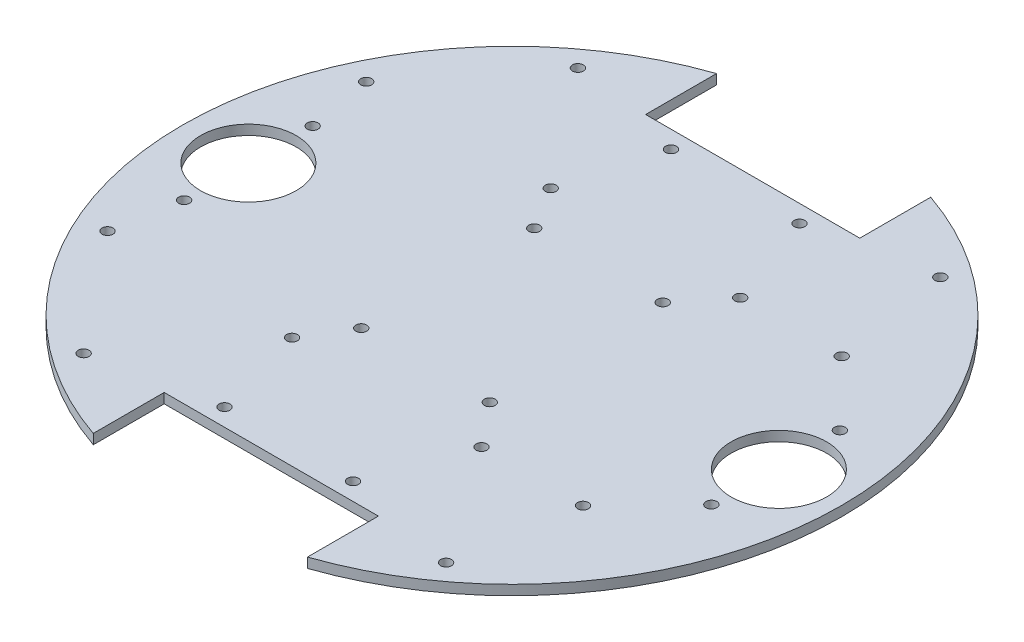
from build123d import *

# Parameters (mm, degrees)
CROQUIS1_R              = 1.65
CROQUIS1_R_2            = 14.5
SALIENTE_EXTRUIR1_DEPTH = 3
CROQUIS2_W              = 1.949367088
CROQUIS2_H              = 14
CROQUIS2_W_2            = 1.772151899
CROQUIS2_H_2            = 10.455696203
CROQUIS2_H_3            = 2.126582279
CORTAR_EXTRUIR1_DEPTH   = 1


with BuildPart() as part:
    # Croquis1 → Saliente-Extruir1 (new body)
    with BuildSketch(Plane(origin=(0, 0, 0), x_dir=(1, 0, 0), z_dir=(0, 1, 0))):
        with BuildLine():
            Line((-32.5, -73.047542064), (32.5, -73.047542064))
            Line((32.5, -73.047542064), (32.5, -94.571401597))
            ThreePointArc((32.5, -94.571401597), (100, 0), (32.5, 94.571401597))
            Line((32.5, 94.571401597), (32.5, 73.047542064))
            Line((32.5, 73.047542064), (-32.5, 73.047542064))
            Line((-32.5, 73.047542064), (-32.5, 94.571401597))
            ThreePointArc((-32.5, 94.571401597), (-100, 0), (-32.5, -94.571401597))
            Line((-32.5, -94.571401597), (-32.5, -73.047542064))
        make_face()
        with Locations(Location((-80, 19.5, 0), (0, 0, 270))):
            Circle(CROQUIS1_R, mode=Mode.SUBTRACT)
        with Locations(Location((-80, -19.5, 0), (0, 0, 90))):
            Circle(CROQUIS1_R, mode=Mode.SUBTRACT)
        with Locations(Location((80, -19.5, 0), (0, 0, 270))):
            Circle(CROQUIS1_R, mode=Mode.SUBTRACT)
        with Locations(Location((80, 19.5, 0), (0, 0, 90))):
            Circle(CROQUIS1_R, mode=Mode.SUBTRACT)
        with Locations(Location((55, 75, 0), (0, 0, 270))):
            Circle(CROQUIS1_R, mode=Mode.SUBTRACT)
        with Locations(Location((-55, 75, 0), (0, 0, 90))):
            Circle(CROQUIS1_R, mode=Mode.SUBTRACT)
        with Locations(Location((55, -75, 0), (0, 0, 90))):
            Circle(CROQUIS1_R, mode=Mode.SUBTRACT)
        with Locations(Location((-55, -75, 0), (0, 0, 270))):
            Circle(CROQUIS1_R, mode=Mode.SUBTRACT)
        with Locations(Location((-80, 0, 0), (0, 0, 270))):
            Circle(CROQUIS1_R_2, mode=Mode.SUBTRACT)
        with Locations(Location((80.990943561, 0, 0), (0, 0, 270))):
            Circle(CROQUIS1_R_2, mode=Mode.SUBTRACT)
        with Locations(Location((-19.5, -67.747542064, 0), (0, 0, 270))):
            Circle(CROQUIS1_R, mode=Mode.SUBTRACT)
        with Locations(Location((19.5, -67.747542064, 0), (0, 0, 90))):
            Circle(CROQUIS1_R, mode=Mode.SUBTRACT)
        with Locations(Location((-19.5, -26.247542064, 0), (0, 0, 270))):
            Circle(CROQUIS1_R, mode=Mode.SUBTRACT)
        with Locations(Location((19.5, -26.247542064, 0), (0, 0, 90))):
            Circle(CROQUIS1_R, mode=Mode.SUBTRACT)
        with Locations(Location((19.5, 26.247542064, 0), (0, 0, 270))):
            Circle(CROQUIS1_R, mode=Mode.SUBTRACT)
        with Locations(Location((-19.5, 26.247542064, 0), (0, 0, 90))):
            Circle(CROQUIS1_R, mode=Mode.SUBTRACT)
        with Locations(Location((-19.5, 67.747542064, 0), (0, 0, 90))):
            Circle(CROQUIS1_R, mode=Mode.SUBTRACT)
        with Locations(Location((19.5, 67.747542064, 0), (0, 0, 270))):
            Circle(CROQUIS1_R, mode=Mode.SUBTRACT)
        with Locations(Location((-27.5, -39.247542064, 0), (0, 0, 270))):
            Circle(CROQUIS1_R, mode=Mode.SUBTRACT)
        with Locations(Location((-83.5, -39.247542064, 0), (0, 0, 270))):
            Circle(CROQUIS1_R, mode=Mode.SUBTRACT)
        with Locations(Location((60.8, -39.247542064, 0), (0, 0, 270))):
            Circle(CROQUIS1_R, mode=Mode.SUBTRACT)
        with Locations(Location((30, -39.247542064, 0), (0, 0, 90))):
            Circle(CROQUIS1_R, mode=Mode.SUBTRACT)
        with Locations(Location((-27.5, 39.247542064, 0), (0, 0, 90))):
            Circle(CROQUIS1_R, mode=Mode.SUBTRACT)
        with Locations(Location((-83.5, 39.247542064, 0), (0, 0, 90))):
            Circle(CROQUIS1_R, mode=Mode.SUBTRACT)
        with Locations(Location((60.8, 39.247542064, 0), (0, 0, 90))):
            Circle(CROQUIS1_R, mode=Mode.SUBTRACT)
        with Locations(Location((30, 39.247542064, 0), (0, 0, 270))):
            Circle(CROQUIS1_R, mode=Mode.SUBTRACT)
    extrude(amount=SALIENTE_EXTRUIR1_DEPTH)

    # Croquis2 → Cortar-Extruir1 (cut)
    # profile 1 of 16: a face of its own
    with BuildSketch(Plane.XZ):
        with Locations((-20.734177215, 10.957677532)):
            Rectangle(CROQUIS2_W, CROQUIS2_H)
    # profile 2 of 16: a face of its own
    with BuildSketch(Plane.XZ):
        Polygon((-17.810126582, 17.957677532), (-5.936708861, 17.957677532), (-5.936708861, 16.362740824), (-10.898734177, 16.362740824), (-10.898734177, 3.957677532), (-12.848101266, 3.957677532), (-12.848101266, 16.362740824), (-17.810126582, 16.362740824), align=None)
    # profile 3 of 16: a face of its own
    with BuildSketch(Plane.XZ):
        Polygon((-0.620253165, 17.957677532), (1.514636076, 17.957677532), (6.82278481, 3.957677532), (4.865110759, 3.957677532), (3.596914557, 7.50198133), (-2.680379747, 7.50198133), (-3.951344937, 3.957677532), (-5.936708861, 3.957677532), align=None)
        Polygon((0.443037975, 16.085842089), (-2.112737342, 9.096918039), (3.007120253, 9.096918039), align=None, mode=Mode.SUBTRACT)
    # profile 4 of 16: a face of its own
    with BuildSketch(Plane.XZ):
        Polygon((8.772151899, 17.957677532), (11.67681962, 17.957677532), (15.146360759, 8.401902216), (18.63528481, 17.957677532), (21.53164557, 17.957677532), (21.53164557, 3.957677532), (19.582278481, 3.957677532), (19.582278481, 16.246443355), (16.076740506, 6.61590538), (14.227056962, 6.61590538), (10.721518987, 16.246443355), (10.721518987, 3.957677532), (8.772151899, 3.957677532), align=None)
    # profile 5 of 16: a face of its own
    with BuildSketch(Plane.XZ):
        with Locations((-45.012658228, -12.194221202)):
            Rectangle(CROQUIS2_W, CROQUIS2_H)
    # profile 6 of 16: a face of its own
    with BuildSketch(Plane.XZ):
        with BuildLine():
            Line((-31.632911392, -12.861547151), (-31.632911392, -19.194221202))
            Line((-31.632911392, -19.194221202), (-33.405063291, -19.194221202))
            Line((-33.405063291, -19.194221202), (-33.405063291, -12.919695885))
            add(Edge.make_bspline(
                [(-33.405063291, -12.919695885), (-33.406185811, -12.79317353), (-33.408360053, -12.548108723), (-33.438421939, -12.193477321), (-33.477293835, -11.862867023), (-33.537940281, -11.557207684), (-33.618132247, -11.276724941), (-33.715424889, -11.020143481), (-33.827376724, -10.787158806), (-33.959212498, -10.578879816), (-34.10878902, -10.395598763), (-34.275950383, -10.236005976), (-34.461613667, -10.101752429), (-34.66356152, -9.989805878), (-34.885462049, -9.90769479), (-35.122950473, -9.846898708), (-35.37796802, -9.806253641), (-35.554558655, -9.803320992), (-35.645174051, -9.801816139)],
                knots=[0, 0, 0, 0, 1.388972905, 2.690341762, 3.906077362, 5.043124479, 6.108230839, 7.105950624, 8.053387478, 8.941956242, 9.80631899, 10.645165862, 11.472357663, 12.316089404, 13.172631324, 14.062586492, 15.005839182, 16, 16, 16, 16], degree=3))
            add(Edge.make_bspline(
                [(-35.645174051, -9.801816139), (-35.754263959, -9.804065365), (-35.967854284, -9.80846919), (-36.27926874, -9.855000066), (-36.574295946, -9.924999377), (-36.849873666, -10.028600566), (-37.108282687, -10.160256414), (-37.348927648, -10.321005585), (-37.573020749, -10.510516489), (-37.773876021, -10.731044035), (-37.957234055, -10.972550823), (-38.111732084, -11.240268277), (-38.249326894, -11.523944212), (-38.355518967, -11.832294383), (-38.443669047, -12.159334178), (-38.497601566, -12.510445042), (-38.540194091, -12.88082113), (-38.542913101, -13.135538582), (-38.544303797, -13.265819303)],
                knots=[0, 0, 0, 0, 1.025291879, 2.00744899, 2.954925218, 3.872417811, 4.769266619, 5.676973556, 6.58845028, 7.522226177, 8.477149863, 9.434477561, 10.424658652, 11.437824348, 12.496957104, 13.605866689, 14.775469011, 16, 16, 16, 16], degree=3))
            Line((-38.544303797, -13.265819303), (-38.544303797, -19.194221202))
            Line((-38.544303797, -19.194221202), (-40.316455696, -19.194221202))
            Line((-40.316455696, -19.194221202), (-40.316455696, -8.738524999))
            Line((-40.316455696, -8.738524999), (-38.544303797, -8.738524999))
            Line((-38.544303797, -8.738524999), (-38.544303797, -10.333461708))
            add(Edge.make_bspline(
                [(-38.544303797, -10.333461708), (-38.442671565, -10.17762109), (-38.245514029, -9.875304084), (-37.897986073, -9.476570108), (-37.525674932, -9.13835326), (-37.125549866, -8.859807481), (-36.69454733, -8.64271409), (-36.229697874, -8.495445446), (-35.735811584, -8.400215316), (-35.395497033, -8.389548027), (-35.221518987, -8.38409462)],
                knots=[0, 0, 0, 0, 1.103250125, 2.140207598, 3.129345088, 4.082208247, 5.025494648, 5.981847872, 6.968265796, 8, 8, 8, 8], degree=3))
            add(Edge.make_bspline(
                [(-35.221518987, -8.38409462), (-35.078249073, -8.386604073), (-34.798869772, -8.391497559), (-34.394765996, -8.449030853), (-34.016746518, -8.536606187), (-33.665723049, -8.66069117), (-33.342656844, -8.823721316), (-33.042417653, -9.016107929), (-32.776454845, -9.253369812), (-32.532599058, -9.519908019), (-32.320897369, -9.823931665), (-32.132493836, -10.158482138), (-31.979917767, -10.52862248), (-31.851440608, -10.930403998), (-31.753356644, -11.366026863), (-31.681411372, -11.835000088), (-31.640461594, -12.337473761), (-31.635478857, -12.68333473), (-31.632911392, -12.861547151)],
                knots=[0, 0, 0, 0, 1.050385716, 2.048273917, 2.987772343, 3.89377739, 4.772000713, 5.637840558, 6.501639044, 7.378948163, 8.282647431, 9.213319016, 10.190521305, 11.214177404, 12.304911297, 13.462777493, 14.692640668, 16, 16, 16, 16], degree=3))
        make_face()
    # profile 7 of 16: a face of its own
    with BuildSketch(Plane.XZ):
        with BuildLine():
            add(Edge.make_bspline(
                [(-19.582278481, -17.91494905), (-19.586042443, -18.126429192), (-19.593337499, -18.536305601), (-19.648160172, -19.130662768), (-19.74221025, -19.683150117), (-19.869697711, -20.194904577), (-20.04062118, -20.663404301), (-20.243230604, -21.092715531), (-20.489452377, -21.477478071), (-20.770312319, -21.822317182), (-21.092656585, -22.123325759), (-21.452293028, -22.386693813), (-21.854901119, -22.604559175), (-22.294583288, -22.78557208), (-22.775044858, -22.923073154), (-23.294101684, -23.020981642), (-23.853300362, -23.083624255), (-24.23953957, -23.089776794), (-24.439082278, -23.092955379)],
                knots=[0, 0, 0, 0, 1.243210938, 2.409506768, 3.504994809, 4.535498388, 5.505356009, 6.43248137, 7.320611659, 8.184234522, 9.040306458, 9.906431668, 10.797689506, 11.724767228, 12.696732594, 13.730089573, 14.827296492, 16, 16, 16, 16], degree=3))
            add(Edge.make_bspline(
                [(-24.439082278, -23.092955379), (-24.589604237, -23.09097775), (-24.886407083, -23.087078214), (-25.324268851, -23.051722696), (-25.749973745, -23.001303968), (-26.163011452, -22.922682049), (-26.566885994, -22.822470415), (-26.962548245, -22.700584067), (-27.353354143, -22.556855016), (-27.606549359, -22.441993), (-27.734177215, -22.38409462)],
                knots=[0, 0, 0, 0, 1.06268762, 2.09543321, 3.100284698, 4.088404365, 5.062146836, 6.037284292, 7.010655884, 8, 8, 8, 8], degree=3))
            Line((-27.734177215, -22.38409462), (-27.734177215, -20.789157911))
            add(Edge.make_bspline(
                [(-27.734177215, -20.789157911), (-27.608708186, -20.862076576), (-27.363616396, -21.004516238), (-26.985256318, -21.18354368), (-26.614410247, -21.340632019), (-26.24173823, -21.462833432), (-25.869071641, -21.55843527), (-25.492979699, -21.622997911), (-25.113932862, -21.667631231), (-24.860097173, -21.672691883), (-24.732594937, -21.67523386)],
                knots=[0, 0, 0, 0, 1.09851719, 2.14584862, 3.167462429, 4.146683605, 5.113021549, 6.078347726, 7.034749748, 8, 8, 8, 8], degree=3))
            add(Edge.make_bspline(
                [(-24.732594937, -21.67523386), (-24.595919331, -21.67237588), (-24.330303589, -21.666821673), (-23.944603194, -21.629734376), (-23.58639523, -21.559823455), (-23.254565515, -21.465754117), (-22.948182641, -21.347819754), (-22.668893486, -21.200587552), (-22.417391582, -21.024160839), (-22.191011453, -20.821609515), (-21.994491624, -20.588929836), (-21.819501027, -20.332438966), (-21.677815845, -20.045075294), (-21.556968447, -19.733296675), (-21.467377291, -19.393074171), (-21.400640789, -19.026595177), (-21.362568848, -18.631993789), (-21.357200231, -18.359913253), (-21.35443038, -18.219537657)],
                knots=[0, 0, 0, 0, 1.182328209, 2.29773984, 3.346858245, 4.334991451, 5.277966442, 6.181587307, 7.058717945, 7.929319754, 8.80138476, 9.687157645, 10.608384529, 11.56624952, 12.575320888, 13.646506894, 14.785752926, 16, 16, 16, 16], degree=3))
            Line((-21.35443038, -18.219537657), (-21.35443038, -17.422069303))
            add(Edge.make_bspline(
                [(-21.35443038, -17.422069303), (-21.445762182, -17.564179894), (-21.62415146, -17.8417503), (-21.950798434, -18.205433006), (-22.313187991, -18.513003849), (-22.713881823, -18.765020527), (-23.153482436, -18.961547992), (-23.635336304, -19.094376159), (-24.15545203, -19.179869664), (-24.516257433, -19.18934152), (-24.702136076, -19.194221202)],
                knots=[0, 0, 0, 0, 1.01712417, 1.986646929, 2.934268058, 3.874491743, 4.831040541, 5.826237211, 6.880127423, 8, 8, 8, 8], degree=3))
            add(Edge.make_bspline(
                [(-24.702136076, -19.194221202), (-24.85839215, -19.190358401), (-25.165123001, -19.182775718), (-25.613776893, -19.111419864), (-26.039745968, -18.996051443), (-26.441137029, -18.831423374), (-26.818068602, -18.620529794), (-27.175852589, -18.368696762), (-27.504922273, -18.063637237), (-27.809358646, -17.717628049), (-28.082405899, -17.333087618), (-28.321435564, -16.915678817), (-28.523693875, -16.467632437), (-28.690063098, -15.990564036), (-28.816818822, -15.483380775), (-28.907282518, -14.947373063), (-28.963641922, -14.381073921), (-28.970944274, -13.993274143), (-28.974683544, -13.794695885)],
                knots=[0, 0, 0, 0, 0.96960766, 1.903340934, 2.812606571, 3.704439413, 4.589488751, 5.489532978, 6.414359887, 7.368603073, 8.346591891, 9.337491901, 10.350582537, 11.394551669, 12.470375698, 13.592492374, 14.767202311, 16, 16, 16, 16], degree=3))
            add(Edge.make_bspline(
                [(-28.974683544, -13.794695885), (-28.970923466, -13.59519895), (-28.963579733, -13.205565529), (-28.907583739, -12.637361067), (-28.816378129, -12.099659879), (-28.690569674, -11.59131532), (-28.523640629, -11.113464489), (-28.321446533, -10.665406744), (-28.082413105, -10.247982924), (-27.80932002, -9.863511777), (-27.505063943, -9.51724951), (-27.174951118, -9.212729887), (-26.818995725, -8.95740913), (-26.441014464, -8.747063628), (-26.039779589, -8.582217422), (-25.613767594, -8.466908944), (-25.165125457, -8.395536673), (-24.858392979, -8.387956263), (-24.702136076, -8.38409462)],
                knots=[0, 0, 0, 0, 1.236954532, 2.415870836, 3.536564133, 4.616573552, 5.659218434, 6.671023987, 7.660667063, 8.637415325, 9.590448076, 10.514101863, 11.416332909, 12.300259584, 13.190961156, 14.09907341, 15.031622265, 16, 16, 16, 16], degree=3))
            add(Edge.make_bspline(
                [(-24.702136076, -8.38409462), (-24.516257433, -8.388974302), (-24.15545203, -8.398446157), (-23.635336304, -8.483939662), (-23.153482436, -8.61676783), (-22.713881823, -8.813295295), (-22.313187991, -9.065311972), (-21.950798434, -9.372882816), (-21.62415146, -9.736565521), (-21.445762182, -10.014135927), (-21.35443038, -10.156246518)],
                knots=[0, 0, 0, 0, 1.119872577, 2.173762789, 3.168959459, 4.125508257, 5.065731942, 6.013353071, 6.98287583, 8, 8, 8, 8], degree=3))
            Line((-21.35443038, -10.156246518), (-21.35443038, -8.738524999))
            Line((-21.35443038, -8.738524999), (-19.582278481, -8.738524999))
            Line((-19.582278481, -8.738524999), (-19.582278481, -17.91494905))
        make_face()
        with BuildLine():
            add(Edge.make_bspline(
                [(-21.35443038, -13.794695885), (-21.356239021, -13.640487485), (-21.359753331, -13.340850288), (-21.396052797, -12.904214327), (-21.457261767, -12.494763592), (-21.537421203, -12.110263832), (-21.650676935, -11.756169304), (-21.778757966, -11.425094923), (-21.937568021, -11.123548221), (-22.117905562, -10.847775081), (-22.318308923, -10.600621697), (-22.542880456, -10.388133119), (-22.785376695, -10.206909026), (-23.046349815, -10.055366185), (-23.329270762, -9.941651548), (-23.630792845, -9.862446), (-23.950883938, -9.810537061), (-24.17120459, -9.804769432), (-24.284018987, -9.801816139)],
                knots=[0, 0, 0, 0, 1.323263917, 2.571189957, 3.756448533, 4.875143256, 5.937446735, 6.943597413, 7.917969694, 8.856119892, 9.767948882, 10.642042153, 11.50231461, 12.361053929, 13.22452985, 14.110353569, 15.032413348, 16, 16, 16, 16], degree=3))
            add(Edge.make_bspline(
                [(-24.284018987, -9.801816139), (-24.395921447, -9.804737998), (-24.614427807, -9.810443367), (-24.932519707, -9.862916), (-25.232595199, -9.940967849), (-25.513891255, -10.056258247), (-25.774130054, -10.205942201), (-26.014252644, -10.389140419), (-26.238761128, -10.600479152), (-26.439009333, -10.847820026), (-26.619472764, -11.123516495), (-26.777923634, -11.425178943), (-26.907286015, -11.755594832), (-27.014998915, -12.111224432), (-27.100984685, -12.494250941), (-27.160530099, -12.904305391), (-27.197312336, -13.340825394), (-27.20075822, -13.640479026), (-27.202531646, -13.794695885)],
                knots=[0, 0, 0, 0, 0.961479455, 1.877433056, 2.764922528, 3.622673805, 4.483027946, 5.338573448, 6.214310412, 7.127854057, 8.067768404, 9.04397295, 10.05201565, 11.113976543, 12.236487631, 13.423975033, 14.674247743, 16, 16, 16, 16], degree=3))
            add(Edge.make_bspline(
                [(-27.202531646, -13.794695885), (-27.200754219, -13.947989229), (-27.197301137, -14.245798767), (-27.160590507, -14.679570259), (-27.100679343, -15.087708284), (-27.015029103, -15.469868244), (-26.907264095, -15.82547561), (-26.777979476, -16.155952711), (-26.61927975, -16.457402775), (-26.440079792, -16.733252428), (-26.236871327, -16.977939188), (-26.015230444, -17.191933786), (-25.77478046, -17.375485821), (-25.513083667, -17.521526328), (-25.232701921, -17.637544004), (-24.932489852, -17.715344983), (-24.614435808, -17.767887151), (-24.395924156, -17.773582801), (-24.284018987, -17.776499683)],
                knots=[0, 0, 0, 0, 1.320149547, 2.56471101, 3.746435789, 4.870932719, 5.934772334, 6.944598368, 7.922529923, 8.864107079, 9.773133752, 10.65591464, 11.512973693, 12.3709173, 13.230186031, 14.119245566, 15.036819585, 16, 16, 16, 16], degree=3))
            add(Edge.make_bspline(
                [(-24.284018987, -17.776499683), (-24.171201852, -17.773551419), (-23.95087585, -17.767793612), (-23.63082293, -17.715814575), (-23.329163861, -17.636860583), (-23.047161689, -17.522410143), (-22.784721387, -17.3745271), (-22.541895009, -17.192949603), (-22.320197754, -16.977797766), (-22.116835455, -16.7332971), (-21.937761027, -16.457371077), (-21.778702069, -16.156036735), (-21.650699154, -15.824901045), (-21.537389936, -15.470829097), (-21.457557508, -15.087197921), (-21.395995972, -14.679660461), (-21.359763603, -14.245774096), (-21.356242711, -13.947980845), (-21.35443038, -13.794695885)],
                knots=[0, 0, 0, 0, 0.969295197, 1.892983131, 2.78037102, 3.645371649, 4.501702115, 5.363493624, 6.244614672, 7.151932156, 8.09173892, 9.067831728, 10.075759046, 11.13993832, 12.260608412, 13.440111264, 14.682332652, 16, 16, 16, 16], degree=3))
        make_face(mode=Mode.SUBTRACT)
    # profile 8 of 16: a face of its own
    with BuildSketch(Plane.XZ):
        with BuildLine():
            Line((-7, -13.346119936), (-7, -14.232195885))
            Line((-7, -14.232195885), (-14.974683544, -14.232195885))
            add(Edge.make_bspline(
                [(-14.974683544, -14.232195885), (-14.963229106, -14.386614188), (-14.940981637, -14.686534317), (-14.86883935, -15.120804623), (-14.778916354, -15.528876862), (-14.650810324, -15.905798811), (-14.507739468, -16.258368286), (-14.326659752, -16.577788981), (-14.126385973, -16.87364136), (-13.894753773, -17.137515509), (-13.638684691, -17.371855379), (-13.357102869, -17.575277031), (-13.05100048, -17.746783629), (-12.722941569, -17.889130847), (-12.369828361, -17.997234571), (-11.993275792, -18.073299409), (-11.593135426, -18.121411483), (-11.318836959, -18.127706927), (-11.178401899, -18.130930063)],
                knots=[0, 0, 0, 0, 1.211264595, 2.352587921, 3.442550356, 4.477399305, 5.464870087, 6.415615379, 7.345380871, 8.256693481, 9.156654215, 10.056904839, 10.969076017, 11.897718264, 12.850547084, 13.853617029, 14.901096946, 16, 16, 16, 16], degree=3))
            add(Edge.make_bspline(
                [(-11.178401899, -18.130930063), (-11.012178649, -18.128271301), (-10.681060062, -18.122975018), (-10.189161728, -18.080383371), (-9.704743096, -18.011039812), (-9.227638043, -17.914011214), (-8.754556175, -17.788274155), (-8.284099074, -17.635822241), (-7.814945886, -17.456603908), (-7.508749703, -17.315811735), (-7.35443038, -17.244854113)],
                knots=[0, 0, 0, 0, 1.007668352, 2.00728671, 2.990989477, 3.973226789, 4.957311491, 5.957180435, 6.97044264, 8, 8, 8, 8], degree=3))
            Line((-7.35443038, -17.244854113), (-7.35443038, -18.839790822))
            add(Edge.make_bspline(
                [(-7.35443038, -18.839790822), (-7.510849875, -18.895711966), (-7.822381557, -19.007086883), (-8.299529883, -19.148338068), (-8.782049749, -19.268714729), (-9.269967401, -19.373729777), (-9.763163587, -19.448657675), (-10.259707013, -19.509045581), (-10.759832075, -19.541934339), (-11.094367027, -19.546413956), (-11.261471519, -19.548651582)],
                knots=[0, 0, 0, 0, 0.998637179, 1.988928042, 2.990336994, 3.988418895, 4.988396725, 5.988590123, 6.995275013, 8, 8, 8, 8], degree=3))
            add(Edge.make_bspline(
                [(-11.261471519, -19.548651582), (-11.467511613, -19.544882079), (-11.868824964, -19.537540052), (-12.454390891, -19.466375739), (-13.007297178, -19.351773456), (-13.527278995, -19.187425774), (-14.015527329, -18.98012614), (-14.470051215, -18.723002751), (-14.892034799, -18.420951333), (-15.278155429, -18.073423082), (-15.623206641, -17.686874417), (-15.924609395, -17.265207067), (-16.180857314, -16.811737418), (-16.389165967, -16.324091185), (-16.549059813, -15.80300672), (-16.664829158, -15.250753248), (-16.73553933, -14.665998184), (-16.743008856, -14.265626381), (-16.746835443, -14.06051867)],
                knots=[0, 0, 0, 0, 1.126511116, 2.19415523, 3.220912648, 4.2108313, 5.172012662, 6.116921692, 7.061183174, 8.004918195, 8.952412997, 9.889630685, 10.834539716, 11.795721077, 12.784132463, 13.810889882, 14.878533995, 16, 16, 16, 16], degree=3))
            add(Edge.make_bspline(
                [(-16.746835443, -14.06051867), (-16.742472712, -13.84808709), (-16.733973285, -13.434230096), (-16.67108802, -12.829957075), (-16.559069563, -12.259892301), (-16.408657722, -11.722756496), (-16.214131057, -11.2180926), (-15.97164676, -10.749780978), (-15.6896283, -10.311551974), (-15.360887119, -9.913958858), (-15.000576057, -9.551694968), (-14.600519813, -9.242235536), (-14.175378125, -8.971966628), (-13.716066696, -8.756737647), (-13.227432125, -8.589831994), (-12.70871739, -8.471389242), (-12.159779479, -8.398298718), (-11.783194764, -8.388894603), (-11.590981013, -8.38409462)],
                knots=[0, 0, 0, 0, 1.176955793, 2.292933033, 3.361095915, 4.392333635, 5.380031643, 6.352115527, 7.309601364, 8.261704601, 9.205544776, 10.134469807, 11.058199752, 11.991562707, 12.937672397, 13.913984649, 14.935270552, 16, 16, 16, 16], degree=3))
            add(Edge.make_bspline(
                [(-11.590981013, -8.38409462), (-11.418215306, -8.388628208), (-11.081730918, -8.397457979), (-10.589927319, -8.458112493), (-10.12758127, -8.5637341), (-9.69045855, -8.707453441), (-9.28240431, -8.895836821), (-8.902671436, -9.128700556), (-8.549064117, -9.39987098), (-8.228488188, -9.715350494), (-7.936736861, -10.061970149), (-7.688031414, -10.445136713), (-7.472864116, -10.854055919), (-7.296970606, -11.294474393), (-7.166812801, -11.766908526), (-7.069526936, -12.266655513), (-7.010331739, -12.796441687), (-7.003507332, -13.159519755), (-7, -13.346119936)],
                knots=[0, 0, 0, 0, 1.084590215, 2.112384922, 3.104827204, 4.057689979, 4.996226111, 5.919468214, 6.849017084, 7.787410098, 8.737820607, 9.687665669, 10.649262925, 11.63491525, 12.658519669, 13.721091171, 14.828778612, 16, 16, 16, 16], degree=3))
        make_face()
        with BuildLine():
            add(Edge.make_bspline(
                [(-8.772151899, -12.814474366), (-8.776073444, -12.702687428), (-8.783744986, -12.484003653), (-8.822195262, -12.165188654), (-8.885670006, -11.863856828), (-8.974822773, -11.580512705), (-9.085880701, -11.313557979), (-9.218067668, -11.062603341), (-9.377954067, -10.831210822), (-9.559687821, -10.618393971), (-9.762944681, -10.428729602), (-9.977293169, -10.256340008), (-10.21383146, -10.11985831), (-10.460416032, -10.000190537), (-10.726572798, -9.914005281), (-11.006389549, -9.844727102), (-11.304052087, -9.811251793), (-11.506929984, -9.805002326), (-11.610363924, -9.801816139)],
                knots=[0, 0, 0, 0, 1.15241404, 2.25441591, 3.304792855, 4.321685273, 5.310974393, 6.281238722, 7.239019324, 8.203718798, 9.159229326, 10.101148619, 11.031030882, 11.967168519, 12.920735747, 13.908239682, 14.933550594, 16, 16, 16, 16], degree=3))
            add(Edge.make_bspline(
                [(-11.610363924, -9.801816139), (-11.727712245, -9.803332277), (-11.957554967, -9.80630184), (-12.292466399, -9.847380394), (-12.610361746, -9.907223547), (-12.910798924, -9.991834015), (-13.190770747, -10.10685312), (-13.453881396, -10.242822413), (-13.698665216, -10.404580715), (-13.925664131, -10.589482519), (-14.131751722, -10.798401517), (-14.313940129, -11.028125845), (-14.473797393, -11.277528406), (-14.609688332, -11.547708852), (-14.722491828, -11.839157804), (-14.814339121, -12.150099239), (-14.880701883, -12.481086837), (-14.906244015, -12.709011589), (-14.919303797, -12.825550316)],
                knots=[0, 0, 0, 0, 1.124896073, 2.203262663, 3.231132974, 4.225871799, 5.190895878, 6.129361928, 7.062425666, 7.999888992, 8.932658686, 9.871458739, 10.80712283, 11.769218643, 12.76714341, 13.800830502, 14.875556903, 16, 16, 16, 16], degree=3))
            Line((-14.919303797, -12.825550316), (-8.772151899, -12.814474366))
        make_face(mode=Mode.SUBTRACT)
    # profile 9 of 16: a face of its own
    with BuildSketch(Plane.XZ):
        with BuildLine():
            Line((4.341772152, -12.861547151), (4.341772152, -19.194221202))
            Line((4.341772152, -19.194221202), (2.569620253, -19.194221202))
            Line((2.569620253, -19.194221202), (2.569620253, -12.919695885))
            add(Edge.make_bspline(
                [(2.569620253, -12.919695885), (2.568497733, -12.79317353), (2.566323491, -12.548108723), (2.536261605, -12.193477321), (2.497389709, -11.862867023), (2.436743263, -11.557207684), (2.356551297, -11.276724941), (2.259258656, -11.020143481), (2.147306821, -10.787158806), (2.015471046, -10.578879816), (1.865894524, -10.395598763), (1.698733161, -10.236005976), (1.513069878, -10.101752429), (1.311122025, -9.989805878), (1.089221495, -9.90769479), (0.851733071, -9.846898708), (0.596715525, -9.806253641), (0.420124889, -9.803320992), (0.329509494, -9.801816139)],
                knots=[0, 0, 0, 0, 1.388972905, 2.690341762, 3.906077362, 5.043124479, 6.108230839, 7.105950624, 8.053387478, 8.941956242, 9.80631899, 10.645165862, 11.472357663, 12.316089404, 13.172631324, 14.062586492, 15.005839182, 16, 16, 16, 16], degree=3))
            add(Edge.make_bspline(
                [(0.329509494, -9.801816139), (0.220419586, -9.804065365), (0.006829261, -9.80846919), (-0.304585195, -9.855000066), (-0.599612401, -9.924999377), (-0.875190121, -10.028600566), (-1.133599143, -10.160256414), (-1.374244104, -10.321005585), (-1.598337205, -10.510516489), (-1.799192477, -10.731044035), (-1.982550511, -10.972550823), (-2.13704854, -11.240268277), (-2.27464335, -11.523944212), (-2.380835423, -11.832294383), (-2.468985503, -12.159334178), (-2.522918021, -12.510445042), (-2.565510547, -12.88082113), (-2.568229557, -13.135538582), (-2.569620253, -13.265819303)],
                knots=[0, 0, 0, 0, 1.025291879, 2.00744899, 2.954925218, 3.872417811, 4.769266619, 5.676973556, 6.58845028, 7.522226177, 8.477149863, 9.434477561, 10.424658652, 11.437824348, 12.496957104, 13.605866689, 14.775469011, 16, 16, 16, 16], degree=3))
            Line((-2.569620253, -13.265819303), (-2.569620253, -19.194221202))
            Line((-2.569620253, -19.194221202), (-4.341772152, -19.194221202))
            Line((-4.341772152, -19.194221202), (-4.341772152, -8.738524999))
            Line((-4.341772152, -8.738524999), (-2.569620253, -8.738524999))
            Line((-2.569620253, -8.738524999), (-2.569620253, -10.333461708))
            add(Edge.make_bspline(
                [(-2.569620253, -10.333461708), (-2.467988021, -10.17762109), (-2.270830485, -9.875304084), (-1.923302529, -9.476570108), (-1.550991388, -9.13835326), (-1.150866322, -8.859807481), (-0.719863786, -8.64271409), (-0.25501433, -8.495445446), (0.23887196, -8.400215316), (0.579186512, -8.389548027), (0.753164557, -8.38409462)],
                knots=[0, 0, 0, 0, 1.103250125, 2.140207598, 3.129345088, 4.082208247, 5.025494648, 5.981847872, 6.968265796, 8, 8, 8, 8], degree=3))
            add(Edge.make_bspline(
                [(0.753164557, -8.38409462), (0.896434471, -8.386604073), (1.175813773, -8.391497559), (1.579917548, -8.449030853), (1.957937026, -8.536606187), (2.308960495, -8.66069117), (2.6320267, -8.823721316), (2.932265891, -9.016107929), (3.198228699, -9.253369812), (3.442084486, -9.519908019), (3.653786176, -9.823931665), (3.842189708, -10.158482138), (3.994765778, -10.52862248), (4.123242936, -10.930403998), (4.2213269, -11.366026863), (4.293272172, -11.835000088), (4.33422195, -12.337473761), (4.339204688, -12.68333473), (4.341772152, -12.861547151)],
                knots=[0, 0, 0, 0, 1.050385716, 2.048273917, 2.987772343, 3.89377739, 4.772000713, 5.637840558, 6.501639044, 7.378948163, 8.282647431, 9.213319016, 10.190521305, 11.214177404, 12.304911297, 13.462777493, 14.692640668, 16, 16, 16, 16], degree=3))
        make_face()
    # profile 10 of 16: a face of its own
    with BuildSketch(Plane.XZ):
        with Locations((8.594936709, -13.966373101)):
            Rectangle(CROQUIS2_W_2, CROQUIS2_H_2)
    # profile 11 of 16: a face of its own
    with BuildSketch(Plane.XZ):
        with Locations((8.594936709, -5.725866771)):
            Rectangle(CROQUIS2_W_2, CROQUIS2_H_3)
    # profile 12 of 16: a face of its own
    with BuildSketch(Plane.XZ):
        with BuildLine():
            Line((22.063291139, -13.346119936), (22.063291139, -14.232195885))
            Line((22.063291139, -14.232195885), (14.088607595, -14.232195885))
            add(Edge.make_bspline(
                [(14.088607595, -14.232195885), (14.100062033, -14.386614188), (14.122309502, -14.686534317), (14.194451789, -15.120804623), (14.284374785, -15.528876862), (14.412480815, -15.905798811), (14.555551671, -16.258368286), (14.736631387, -16.577788981), (14.936905166, -16.87364136), (15.168537366, -17.137515509), (15.424606449, -17.371855379), (15.70618827, -17.575277031), (16.012290659, -17.746783629), (16.34034957, -17.889130847), (16.693462778, -17.997234571), (17.070015348, -18.073299409), (17.470155713, -18.121411483), (17.74445418, -18.127706927), (17.884889241, -18.130930063)],
                knots=[0, 0, 0, 0, 1.211264595, 2.352587921, 3.442550356, 4.477399305, 5.464870087, 6.415615379, 7.345380871, 8.256693481, 9.156654215, 10.056904839, 10.969076017, 11.897718264, 12.850547084, 13.853617029, 14.901096946, 16, 16, 16, 16], degree=3))
            add(Edge.make_bspline(
                [(17.884889241, -18.130930063), (18.051112491, -18.128271301), (18.382231078, -18.122975018), (18.874129411, -18.080383371), (19.358548043, -18.011039812), (19.835653096, -17.914011214), (20.308734964, -17.788274155), (20.779192066, -17.635822241), (21.248345253, -17.456603908), (21.554541436, -17.315811735), (21.708860759, -17.244854113)],
                knots=[0, 0, 0, 0, 1.007668352, 2.00728671, 2.990989477, 3.973226789, 4.957311491, 5.957180435, 6.97044264, 8, 8, 8, 8], degree=3))
            Line((21.708860759, -17.244854113), (21.708860759, -18.839790822))
            add(Edge.make_bspline(
                [(21.708860759, -18.839790822), (21.552441264, -18.895711966), (21.240909582, -19.007086883), (20.763761256, -19.148338068), (20.28124139, -19.268714729), (19.793323738, -19.373729777), (19.300127552, -19.448657675), (18.803584127, -19.509045581), (18.303459065, -19.541934339), (17.968924112, -19.546413956), (17.80181962, -19.548651582)],
                knots=[0, 0, 0, 0, 0.998637179, 1.988928042, 2.990336994, 3.988418895, 4.988396725, 5.988590123, 6.995275013, 8, 8, 8, 8], degree=3))
            add(Edge.make_bspline(
                [(17.80181962, -19.548651582), (17.595779526, -19.544882079), (17.194466175, -19.537540052), (16.608900248, -19.466375739), (16.055993961, -19.351773456), (15.536012145, -19.187425774), (15.047763811, -18.98012614), (14.593239924, -18.723002751), (14.171256341, -18.420951333), (13.78513571, -18.073423082), (13.440084499, -17.686874417), (13.138681744, -17.265207067), (12.882433825, -16.811737418), (12.674125173, -16.324091185), (12.514231326, -15.80300672), (12.398461982, -15.250753248), (12.327751809, -14.665998184), (12.320282283, -14.265626381), (12.316455696, -14.06051867)],
                knots=[0, 0, 0, 0, 1.126511116, 2.19415523, 3.220912648, 4.2108313, 5.172012662, 6.116921692, 7.061183174, 8.004918195, 8.952412997, 9.889630685, 10.834539716, 11.795721077, 12.784132463, 13.810889882, 14.878533995, 16, 16, 16, 16], degree=3))
            add(Edge.make_bspline(
                [(12.316455696, -14.06051867), (12.320818427, -13.84808709), (12.329317854, -13.434230096), (12.392203119, -12.829957075), (12.504221576, -12.259892301), (12.654633417, -11.722756496), (12.849160082, -11.2180926), (13.091644379, -10.749780978), (13.373662839, -10.311551974), (13.70240402, -9.913958858), (14.062715083, -9.551694968), (14.462771326, -9.242235536), (14.887913014, -8.971966628), (15.347224443, -8.756737647), (15.835859014, -8.589831994), (16.354573749, -8.471389242), (16.90351166, -8.398298718), (17.280096375, -8.388894603), (17.472310127, -8.38409462)],
                knots=[0, 0, 0, 0, 1.176955793, 2.292933033, 3.361095915, 4.392333635, 5.380031643, 6.352115527, 7.309601364, 8.261704601, 9.205544776, 10.134469807, 11.058199752, 11.991562707, 12.937672397, 13.913984649, 14.935270552, 16, 16, 16, 16], degree=3))
            add(Edge.make_bspline(
                [(17.472310127, -8.38409462), (17.645075833, -8.388628208), (17.981560221, -8.397457979), (18.473363821, -8.458112493), (18.93570987, -8.5637341), (19.37283259, -8.707453441), (19.78088683, -8.895836821), (20.160619703, -9.128700556), (20.514227023, -9.39987098), (20.834802951, -9.715350494), (21.126554278, -10.061970149), (21.375259726, -10.445136713), (21.590427023, -10.854055919), (21.766320533, -11.294474393), (21.896478338, -11.766908526), (21.993764203, -12.266655513), (22.052959401, -12.796441687), (22.059783807, -13.159519755), (22.063291139, -13.346119936)],
                knots=[0, 0, 0, 0, 1.084590215, 2.112384922, 3.104827204, 4.057689979, 4.996226111, 5.919468214, 6.849017084, 7.787410098, 8.737820607, 9.687665669, 10.649262925, 11.63491525, 12.658519669, 13.721091171, 14.828778612, 16, 16, 16, 16], degree=3))
        make_face()
        with BuildLine():
            add(Edge.make_bspline(
                [(20.291139241, -12.814474366), (20.287217696, -12.702687428), (20.279546153, -12.484003653), (20.241095877, -12.165188654), (20.177621133, -11.863856828), (20.088468366, -11.580512705), (19.977410439, -11.313557979), (19.845223471, -11.062603341), (19.685337073, -10.831210822), (19.503603319, -10.618393971), (19.300346458, -10.428729602), (19.08599797, -10.256340008), (18.849459679, -10.11985831), (18.602875107, -10.000190537), (18.336718341, -9.914005281), (18.05690159, -9.844727102), (17.759239052, -9.811251793), (17.556361156, -9.805002326), (17.452927215, -9.801816139)],
                knots=[0, 0, 0, 0, 1.15241404, 2.25441591, 3.304792855, 4.321685273, 5.310974393, 6.281238722, 7.239019324, 8.203718798, 9.159229326, 10.101148619, 11.031030882, 11.967168519, 12.920735747, 13.908239682, 14.933550594, 16, 16, 16, 16], degree=3))
            add(Edge.make_bspline(
                [(17.452927215, -9.801816139), (17.335578894, -9.803332277), (17.105736172, -9.80630184), (16.770824741, -9.847380394), (16.452929393, -9.907223547), (16.152492215, -9.991834015), (15.872520392, -10.10685312), (15.609409743, -10.242822413), (15.364625923, -10.404580715), (15.137627008, -10.589482519), (14.931539417, -10.798401517), (14.749351011, -11.028125845), (14.589493746, -11.277528406), (14.453602808, -11.547708852), (14.340799311, -11.839157804), (14.248952018, -12.150099239), (14.182589256, -12.481086837), (14.157047124, -12.709011589), (14.143987342, -12.825550316)],
                knots=[0, 0, 0, 0, 1.124896073, 2.203262663, 3.231132974, 4.225871799, 5.190895878, 6.129361928, 7.062425666, 7.999888992, 8.932658686, 9.871458739, 10.80712283, 11.769218643, 12.76714341, 13.800830502, 14.875556903, 16, 16, 16, 16], degree=3))
            Line((14.143987342, -12.825550316), (20.291139241, -12.814474366))
        make_face(mode=Mode.SUBTRACT)
    # profile 13 of 16: a face of its own
    with BuildSketch(Plane.XZ):
        with BuildLine():
            add(Edge.make_bspline(
                [(30.924050633, -10.333461708), (30.824079782, -10.277467933), (30.62280525, -10.164733862), (30.286014785, -10.055245716), (29.91958586, -9.990908229), (29.664452181, -9.983105196), (29.53125, -9.979031328)],
                knots=[0, 0, 0, 0, 0.942720173, 1.898008876, 2.902576073, 4, 4, 4, 4], degree=3))
            add(Edge.make_bspline(
                [(29.53125, -9.979031328), (29.412034978, -9.981314525), (29.180109371, -9.985756347), (28.843363228, -10.030975918), (28.528324164, -10.10472042), (28.235447616, -10.211406481), (27.961674831, -10.344522878), (27.708263635, -10.507482841), (27.479444484, -10.704973125), (27.270936204, -10.928808915), (27.088957297, -11.183436898), (26.926528718, -11.460295558), (26.794489672, -11.766188117), (26.683666203, -12.095752378), (26.597797593, -12.452518889), (26.539238173, -12.8351193), (26.497949821, -13.242771722), (26.495123214, -13.5232243), (26.493670886, -13.667322468)],
                knots=[0, 0, 0, 0, 1.05245723, 2.047491816, 2.9946521, 3.904994099, 4.79462156, 5.678778489, 6.557733341, 7.457685357, 8.374139545, 9.316586685, 10.287551376, 11.311034419, 12.38471703, 13.523963392, 14.727797968, 16, 16, 16, 16], degree=3))
            Line((26.493670886, -13.667322468), (26.493670886, -19.194221202))
            Line((26.493670886, -19.194221202), (24.721518987, -19.194221202))
            Line((24.721518987, -19.194221202), (24.721518987, -8.738524999))
            Line((24.721518987, -8.738524999), (26.493670886, -8.738524999))
            Line((26.493670886, -8.738524999), (26.493670886, -10.333461708))
            add(Edge.make_bspline(
                [(26.493670886, -10.333461708), (26.587222445, -10.176368497), (26.769731869, -9.869895875), (27.109912228, -9.468999044), (27.486700577, -9.127210224), (27.911047222, -8.853224345), (28.379193984, -8.64231014), (28.891692522, -8.488397112), (29.451660046, -8.401207878), (29.840151959, -8.389921938), (30.040743671, -8.38409462)],
                knots=[0, 0, 0, 0, 1.025823694, 2.001276026, 2.941473275, 3.875053327, 4.82661044, 5.817614095, 6.873159232, 8, 8, 8, 8], degree=3))
            add(Edge.make_bspline(
                [(30.040743671, -8.38409462), (30.103642059, -8.386403644), (30.235763172, -8.391253863), (30.443872075, -8.428227114), (30.673376134, -8.483116214), (30.83207362, -8.534315839), (30.915743671, -8.561309809)],
                knots=[0, 0, 0, 0, 0.841814394, 1.768271923, 2.823366358, 4, 4, 4, 4], degree=3))
            Line((30.915743671, -8.561309809), (30.924050633, -10.333461708))
        make_face()
    # profile 14 of 16: a face of its own
    with BuildSketch(Plane.XZ):
        Polygon((34.753560127, -3.953714873), (36.594936709, -3.953714873), (33.579509494, -7.49801867), (32.164556962, -7.49801867), align=None)
    # profile 15 of 16: a face of its own
    with BuildSketch(Plane.XZ):
        with Locations((33.405063291, -13.966373101)):
            Rectangle(CROQUIS2_W_2, CROQUIS2_H_2)
    # profile 16 of 16: a face of its own
    with BuildSketch(Plane.XZ):
        with BuildLine():
            Line((45.987341772, -13.307354113), (45.987341772, -19.194221202))
            Line((45.987341772, -19.194221202), (44.215189873, -19.194221202))
            Line((44.215189873, -19.194221202), (44.215189873, -17.599284493))
            add(Edge.make_bspline(
                [(44.215189873, -17.599284493), (44.116065538, -17.758320609), (43.923022513, -18.068040849), (43.569392118, -18.470897882), (43.183904756, -18.812539874), (42.758023708, -19.08663957), (42.289799011, -19.298068032), (41.774506177, -19.44245434), (41.211212406, -19.532374066), (40.818925086, -19.543093216), (40.615506329, -19.548651582)],
                knots=[0, 0, 0, 0, 1.041273324, 2.027862813, 2.970480734, 3.899328223, 4.834867772, 5.818297338, 6.868688276, 8, 8, 8, 8], degree=3))
            add(Edge.make_bspline(
                [(40.615506329, -19.548651582), (40.485259816, -19.546078771), (40.23145544, -19.541065272), (39.860624024, -19.49955574), (39.510564015, -19.427176605), (39.180102958, -19.328338895), (38.870408321, -19.199950644), (38.581302137, -19.045006486), (38.312497765, -18.860681942), (38.068027033, -18.647426935), (37.844483522, -18.412955433), (37.654514902, -18.153362937), (37.48878162, -17.878261569), (37.355457949, -17.582609354), (37.253556638, -17.267452722), (37.178545494, -16.933943933), (37.133490957, -16.580613095), (37.128920566, -16.338605778), (37.126582278, -16.214790822)],
                knots=[0, 0, 0, 0, 1.146766293, 2.234641813, 3.280344341, 4.290865758, 5.267476277, 6.227542416, 7.174444004, 8.13099429, 9.079742948, 10.020976301, 10.957706792, 11.903491421, 12.869935896, 13.869678111, 14.910092002, 16, 16, 16, 16], degree=3))
            add(Edge.make_bspline(
                [(37.126582278, -16.214790822), (37.130318897, -16.071539246), (37.137604422, -15.792232455), (37.193580795, -15.387731642), (37.284115203, -15.009276561), (37.414746042, -14.658928649), (37.581668178, -14.335131017), (37.785121623, -14.038103508), (38.028568114, -13.771416729), (38.307803474, -13.530506677), (38.626299952, -13.322040454), (38.976805451, -13.133394363), (39.367189574, -12.980824932), (39.791934098, -12.85245751), (40.253957601, -12.758505566), (40.751045712, -12.685230071), (41.28493433, -12.644980201), (41.652891477, -12.639881788), (41.842167722, -12.637259176)],
                knots=[0, 0, 0, 0, 1.019029206, 1.98686665, 2.899609872, 3.782835699, 4.64056668, 5.485861531, 6.336751054, 7.202988998, 8.102834139, 9.040082545, 10.030388827, 11.079678452, 12.193884325, 13.381837275, 14.653223581, 16, 16, 16, 16], degree=3))
            Line((41.842167722, -12.637259176), (44.215189873, -12.637259176))
            Line((44.215189873, -12.637259176), (44.215189873, -12.454506012))
            add(Edge.make_bspline(
                [(44.215189873, -12.454506012), (44.213700566, -12.351902036), (44.210790908, -12.151444824), (44.169637899, -11.860742813), (44.110515099, -11.587556346), (44.024051446, -11.332975504), (43.912039648, -11.097102025), (43.780217665, -10.875221713), (43.616746402, -10.676202645), (43.434028022, -10.492377127), (43.2283044, -10.327962912), (43.000520236, -10.187964912), (42.754411643, -10.066665802), (42.487106635, -9.971799534), (42.201689724, -9.892291484), (41.895193688, -9.842609842), (41.570701653, -9.807428542), (41.347546329, -9.803719936), (41.232990506, -9.801816139)],
                knots=[0, 0, 0, 0, 1.085531131, 2.120800302, 3.102412705, 4.041963971, 4.960074266, 5.86350224, 6.767088788, 7.679302159, 8.604253289, 9.548014059, 10.505240579, 11.503879638, 12.547053145, 13.638026009, 14.787490842, 16, 16, 16, 16], degree=3))
            add(Edge.make_bspline(
                [(41.232990506, -9.801816139), (41.083364371, -9.804411005), (40.786301108, -9.809562776), (40.34334587, -9.853038864), (39.906674356, -9.921303061), (39.475819323, -10.019135427), (39.052685102, -10.142716749), (38.638073291, -10.297068289), (38.230115438, -10.475415656), (37.96744254, -10.616828636), (37.835443038, -10.687892088)],
                knots=[0, 0, 0, 0, 1.011363261, 2.007930441, 3.006117787, 3.997671155, 4.992830754, 5.983912777, 6.986867275, 8, 8, 8, 8], degree=3))
            Line((37.835443038, -10.687892088), (37.835443038, -9.092955379))
            add(Edge.make_bspline(
                [(37.835443038, -9.092955379), (37.992857126, -9.036347484), (38.303031805, -8.924805143), (38.769592207, -8.780804), (39.228704528, -8.658908945), (39.681266722, -8.558542129), (40.127521943, -8.480649939), (40.56736249, -8.425546667), (41.000750143, -8.390601468), (41.287383675, -8.386252322), (41.429588608, -8.38409462)],
                knots=[0, 0, 0, 0, 1.09010988, 2.147993781, 3.181026798, 4.185160661, 5.168171667, 6.132151737, 7.073321132, 8, 8, 8, 8], degree=3))
            add(Edge.make_bspline(
                [(41.429588608, -8.38409462), (41.61435907, -8.387541898), (41.973787024, -8.394247775), (42.494074834, -8.453800456), (42.979246173, -8.545975993), (43.427702239, -8.678726114), (43.840446464, -8.850482618), (44.217454649, -9.061656322), (44.557170043, -9.312665782), (44.8622344, -9.600012983), (45.13050945, -9.927340209), (45.360651945, -10.295506919), (45.553844755, -10.703260362), (45.715757062, -11.147677681), (45.835166322, -11.632747569), (45.92281708, -12.155677541), (45.980078709, -12.718141775), (45.984871052, -13.106918163), (45.987341772, -13.307354113)],
                knots=[0, 0, 0, 0, 1.150889786, 2.238788363, 3.258374462, 4.224547409, 5.14735179, 6.038300219, 6.91016815, 7.772615567, 8.642983828, 9.539704481, 10.470857621, 11.449597236, 12.481756567, 13.578481222, 14.751571774, 16, 16, 16, 16], degree=3))
        make_face()
        with BuildLine():
            add(Edge.make_bspline(
                [(42.53164557, -14.054980695), (42.367320918, -14.056618143), (42.051437526, -14.05976583), (41.597080244, -14.082361318), (41.181910992, -14.115964283), (40.805982182, -14.169559803), (40.468560607, -14.233264716), (40.171148111, -14.31577253), (39.91345825, -14.413027671), (39.690060799, -14.522699598), (39.501102493, -14.656063341), (39.338566073, -14.806595744), (39.200574594, -14.977755672), (39.089240526, -15.171271203), (39.002921006, -15.386701192), (38.944207431, -15.62348582), (38.902923681, -15.879235397), (38.900159554, -16.056780465), (38.898734177, -16.148335126)],
                knots=[0, 0, 0, 0, 1.643063966, 3.158483007, 4.548080357, 5.806326948, 6.953892599, 7.979517819, 8.88799134, 9.705248103, 10.460593118, 11.19198918, 11.914125949, 12.650223705, 13.416318315, 14.22666679, 15.08554531, 16, 16, 16, 16], degree=3))
            add(Edge.make_bspline(
                [(38.898734177, -16.148335126), (38.900048445, -16.222265627), (38.902621143, -16.36698572), (38.931025709, -16.578487563), (38.9777291, -16.779032175), (39.04421209, -16.967332853), (39.128363765, -17.143259045), (39.227976471, -17.309369387), (39.350536156, -17.460549008), (39.489669274, -17.599846007), (39.644587106, -17.724546048), (39.815352385, -17.832363621), (39.99701498, -17.927214341), (40.194150503, -18.002442243), (40.403917057, -18.05968365), (40.626196546, -18.100953395), (40.861344139, -18.126614854), (41.022478854, -18.129461383), (41.105617089, -18.130930063)],
                knots=[0, 0, 0, 0, 1.057611255, 2.070290295, 3.047625745, 4.000274052, 4.922104004, 5.835183412, 6.765681621, 7.699830141, 8.648899293, 9.605387095, 10.586198557, 11.577364914, 12.619013819, 13.694299516, 14.810362685, 16, 16, 16, 16], degree=3))
            add(Edge.make_bspline(
                [(41.105617089, -18.130930063), (41.220249086, -18.127753283), (41.444049968, -18.121551122), (41.771403789, -18.07253406), (42.082160033, -17.996729765), (42.375592638, -17.885801089), (42.648008717, -17.738240541), (42.908178884, -17.568047293), (43.147525894, -17.35988755), (43.367515582, -17.12249629), (43.567085393, -16.859137777), (43.741629345, -16.573555442), (43.889688797, -16.266728082), (44.007896785, -15.937745858), (44.10234343, -15.588769274), (44.168115636, -15.219088485), (44.207037579, -14.829290388), (44.212426498, -14.562719485), (44.215189873, -14.426024999)],
                knots=[0, 0, 0, 0, 1.010399151, 1.972644876, 2.912251271, 3.826741703, 4.729678217, 5.639375384, 6.562768192, 7.51872895, 8.488893116, 9.471573858, 10.465348086, 11.487512186, 12.549687727, 13.649638655, 14.794761806, 16, 16, 16, 16], degree=3))
            Line((44.215189873, -14.426024999), (44.215189873, -14.054980695))
            Line((44.215189873, -14.054980695), (42.53164557, -14.054980695))
        make_face(mode=Mode.SUBTRACT)
    extrude(amount=-CORTAR_EXTRUIR1_DEPTH, mode=Mode.SUBTRACT)


solid = part.part
